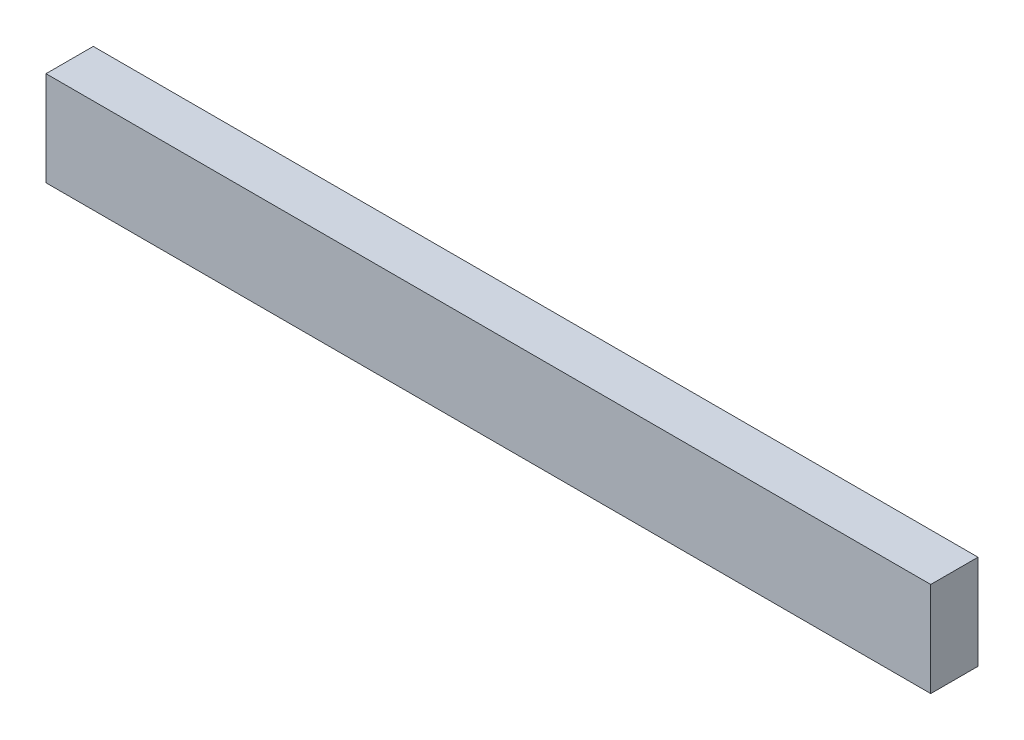
from build123d import *

# Parameters (mm, degrees)
ESQUISSE1_W        = 468
ESQUISSE1_H        = 50
BOSS_EXTRU_1_DEPTH = 25


with BuildPart() as part:
    # Esquisse1 → Boss.-Extru.1 (new body)
    with BuildSketch(Plane.XY):
        with Locations((234, 25)):
            Rectangle(ESQUISSE1_W, ESQUISSE1_H)
    extrude(amount=BOSS_EXTRU_1_DEPTH)


solid = part.part
